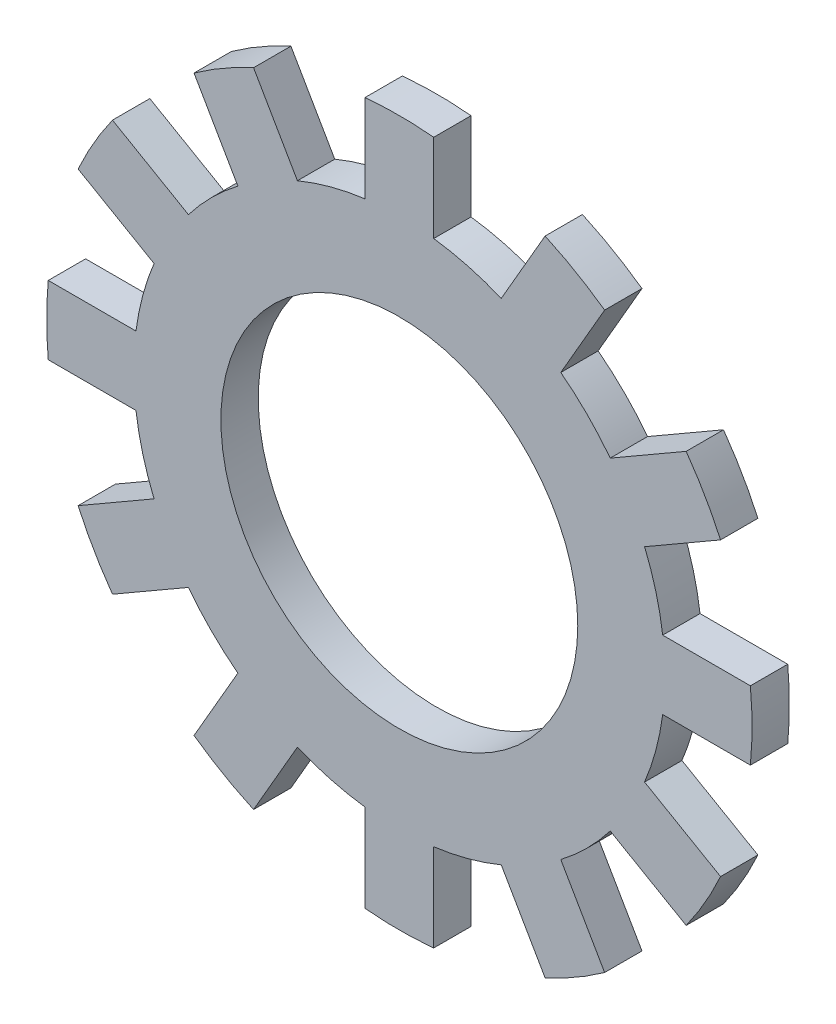
from build123d import *

# Parameters (mm, degrees)
SKETCH1_R         = 3.2
SKETCH1_R_2       = 2.15
EXTRUDE1_DEPTH    = 0.45
EXTRUDE2_DEPTH    = 0.45
CIRPATTERN1_COUNT = 12


with BuildPart() as part:
    # Sketch1 → Extrude1 (new body)
    with BuildSketch(Plane.XY):
        Circle(SKETCH1_R)
        Circle(SKETCH1_R_2, mode=Mode.SUBTRACT)
    extrude(amount=EXTRUDE1_DEPTH)

    # Sketch2 → Extrude2 (add)
    with BuildSketch(Plane.XY):
        with BuildLine():
            Line((-0.414110472, 4.229776887), (-0.414110472, 3.173091949))
            Line((-0.414110472, 3.173091949), (0.414110472, 3.173091949))
            Line((0.414110472, 3.173091949), (0.414110472, 4.229776887))
            ThreePointArc((0.414110472, 4.229776887), (0, 4.25), (-0.414110472, 4.229776887))
        make_face()
    extrude2 = extrude(amount=EXTRUDE2_DEPTH)

    # CirPattern1: Extrude2 ×12 about axis
    cirpattern1_axis = Axis((0, 0, 0), (0, 0, 1))
    for i in range(1, CIRPATTERN1_COUNT):
        add(extrude2.rotate(cirpattern1_axis, i * 360 / CIRPATTERN1_COUNT))


solid = part.part
